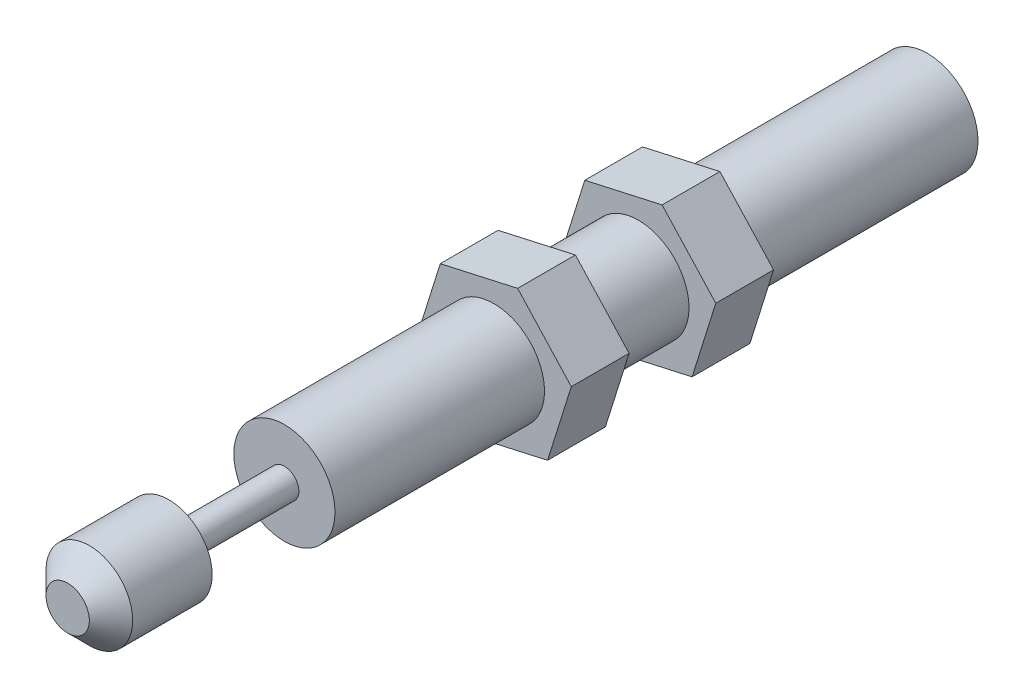
from build123d import *

# Parameters (mm, degrees)
SKETCH_1_R             = 7
EXTRUDE_1_DEPTH        = 89
SKETCH_2_R             = 2
EXTRUDE_2_DEPTH        = 16
SKETCH_3_R             = 6
EXTRUDE_3_DEPTH        = 14
CHAMFER_1_SIZE         = 3
EXTRUDE_4_DEPTH        = 8
PATTERN_LINEAR_1_COUNT = 2
PATTERN_LINEAR_1_PITCH = 20


with BuildPart() as part:
    # 草图1 → 凸台-拉伸1 (new body)
    with BuildSketch(Plane.XY):
        Circle(SKETCH_1_R)
    extrude(amount=EXTRUDE_1_DEPTH)

    # 草图2 → 凸台-拉伸2 (add)
    with BuildSketch(Plane.XY.offset(89)):
        Circle(SKETCH_2_R)
    extrude(amount=EXTRUDE_2_DEPTH)

    # 草图3 → 凸台-拉伸3 (add)
    with BuildSketch(Plane.XY.offset(105)):
        Circle(SKETCH_3_R)
    extrude(amount=EXTRUDE_3_DEPTH)

    # 倒角1
    chamfer_1_edges = [part.edges().sort_by_distance(p)[0] for p in [
        (-6, 0, 119),
    ]]
    chamfer(chamfer_1_edges, length=CHAMFER_1_SIZE)

    # 草图4 → 凸台-拉伸4 (add)
    with BuildSketch(Plane(origin=(0, 0, 40), x_dir=(-1, 0, 0), z_dir=(0, 0, -1))):
        Polygon((-3.277805691, 10.468491925), (-10.704882792, 2.395582966), (-7.427077101, -8.07290896), (3.277805691, -10.468491925), (10.704882792, -2.395582966), (7.427077101, 8.07290896), align=None)
    extrude_4 = extrude(amount=EXTRUDE_4_DEPTH)

    # 阵列(线性)1: 凸台-拉伸4 ×2
    with Locations(*[(0, 0, i * PATTERN_LINEAR_1_PITCH) for i in range(1, PATTERN_LINEAR_1_COUNT)]):
        add(extrude_4)


solid = part.part
